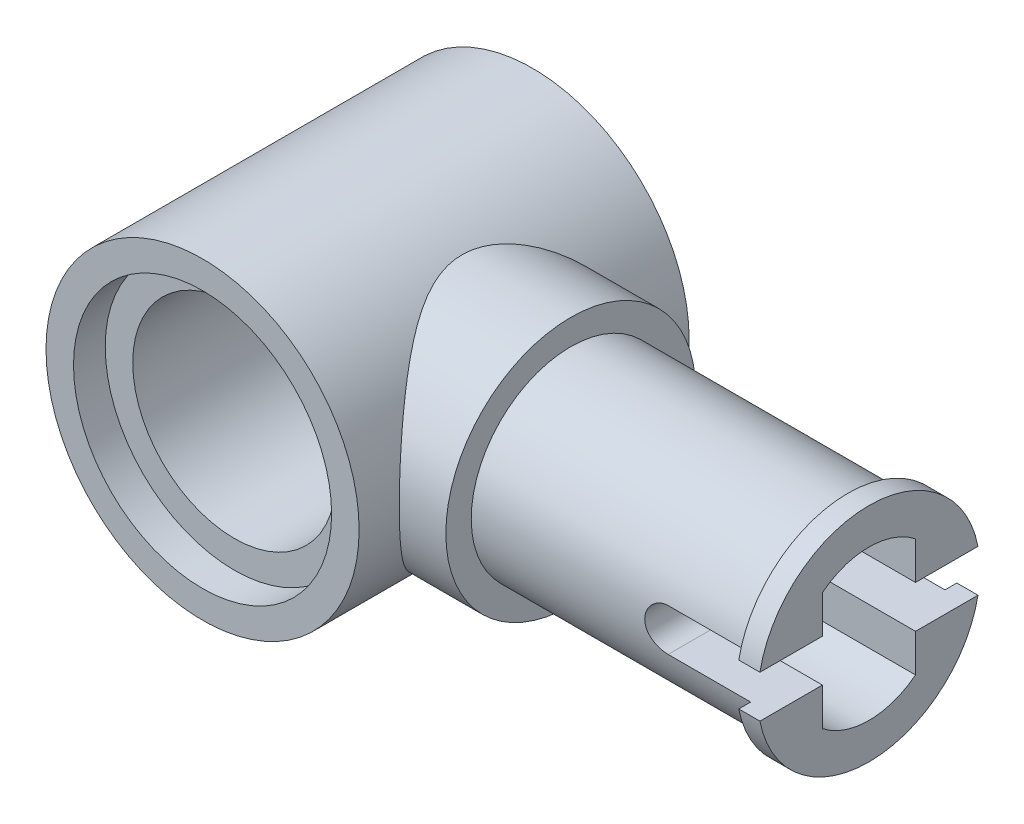
from build123d import *

# Parameters (mm, degrees)
SKETCH1_R              = 2.35
PIN_DEPTH              = 11.35
SKETCH2_R              = 2.95
MIDDLE_DEPTH           = 4.8
SKETCH3_R              = 2.625
OUTER_RIM_DEPTH        = 0.5
BORE_CUT_DEPTH         = 13.562941535
SLOT_CUT_DEPTH         = 13.562941535
SLOT_CUT_DEPTH_BACK    = 13.562941535
SKETCH6_R              = 3.7
MIDDLE_BODY_DEPTH      = 3.9
MIDDLE_BORE_DEPTH      = 14.012398084
MIDDLE_BORE_DEPTH_BACK = 14.012398084
SKETCH7_R              = 2.4
SKETCH8_R              = 3.05
MIDDLE_RIM_CUT_DEPTH   = 0.75


with BuildPart() as part:
    # Sketch1 → Pin (new body)
    with BuildSketch(Plane(origin=(0, 0, 0), x_dir=(0, 0, -1), z_dir=(1, 0, 0))):
        Circle(SKETCH1_R)
    extrude(amount=PIN_DEPTH)

    # Sketch2 → Middle (add)
    with BuildSketch(Plane(origin=(0, 0, 0), x_dir=(0, 0, -1), z_dir=(1, 0, 0))):
        Circle(SKETCH2_R)
    extrude(amount=MIDDLE_DEPTH)

    # Sketch3 → Outer Rim (add)
    with BuildSketch(Plane(origin=(11.35, 0, 0), x_dir=(0, 0, -1), z_dir=(1, 0, 0))):
        Circle(SKETCH3_R)
    extrude(amount=OUTER_RIM_DEPTH)

    # Sketch4 → Bore Cut (cut, through all)
    with BuildSketch(Plane(origin=(0, 0, 0), x_dir=(0, 0, -1), z_dir=(1, 0, 0))):
        with BuildLine():
            ThreePointArc((-1.1, -1.393063172), (0, -1.775), (1.1, -1.393063172))
            Line((1.1, -1.393063172), (1.1, 1.393063172))
            ThreePointArc((1.1, 1.393063172), (0, 1.775), (-1.1, 1.393063172))
            Line((-1.1, 1.393063172), (-1.1, -1.393063172))
        make_face()
    extrude(amount=BORE_CUT_DEPTH, mode=Mode.SUBTRACT)

    # Sketch5 → Slot Cut (cut, two sides: drawn at the far end of the back side and taken through both)
    with BuildSketch(Plane.XY.offset(-SLOT_CUT_DEPTH_BACK)):
        with BuildLine():
            Line((14.3, -0.5), (9.4, -0.5))
            ThreePointArc((9.4, -0.5), (8.9, 0), (9.4, 0.5))
            Line((9.4, 0.5), (14.3, 0.5))
            ThreePointArc((14.3, 0.5), (14.8, 0), (14.3, -0.5))
        make_face()
        with BuildLine():
            Line((-14.3, -0.5), (-9.4, -0.5))
            ThreePointArc((-9.4, -0.5), (-8.9, 0), (-9.4, 0.5))
            Line((-9.4, 0.5), (-14.3, 0.5))
            ThreePointArc((-14.3, 0.5), (-14.8, 0), (-14.3, -0.5))
        make_face()
    extrude(amount=SLOT_CUT_DEPTH + SLOT_CUT_DEPTH_BACK, mode=Mode.SUBTRACT)

    # Sketch6 → Middle Body (add, symmetric)
    with BuildSketch(Plane.XY):
        Circle(SKETCH6_R)
    extrude(amount=MIDDLE_BODY_DEPTH, both=True)

    # Sketch7 → Middle Bore (cut, two sides: drawn at the far end of the back side and taken through both)
    with BuildSketch(Plane.XY.offset(-MIDDLE_BORE_DEPTH_BACK)):
        Circle(SKETCH7_R)
    extrude(amount=MIDDLE_BORE_DEPTH + MIDDLE_BORE_DEPTH_BACK, mode=Mode.SUBTRACT)

    # Sketch8 → Middle Rim Cut (cut)
    with BuildSketch(Plane.XY.offset(3.9)):
        Circle(SKETCH8_R)
    middle_rim_cut = extrude(amount=-MIDDLE_RIM_CUT_DEPTH, mode=Mode.SUBTRACT)

    # Mirror2: Middle Rim Cut across plane
    add(middle_rim_cut.mirror(Plane.XY), mode=Mode.SUBTRACT)


solid = part.part
